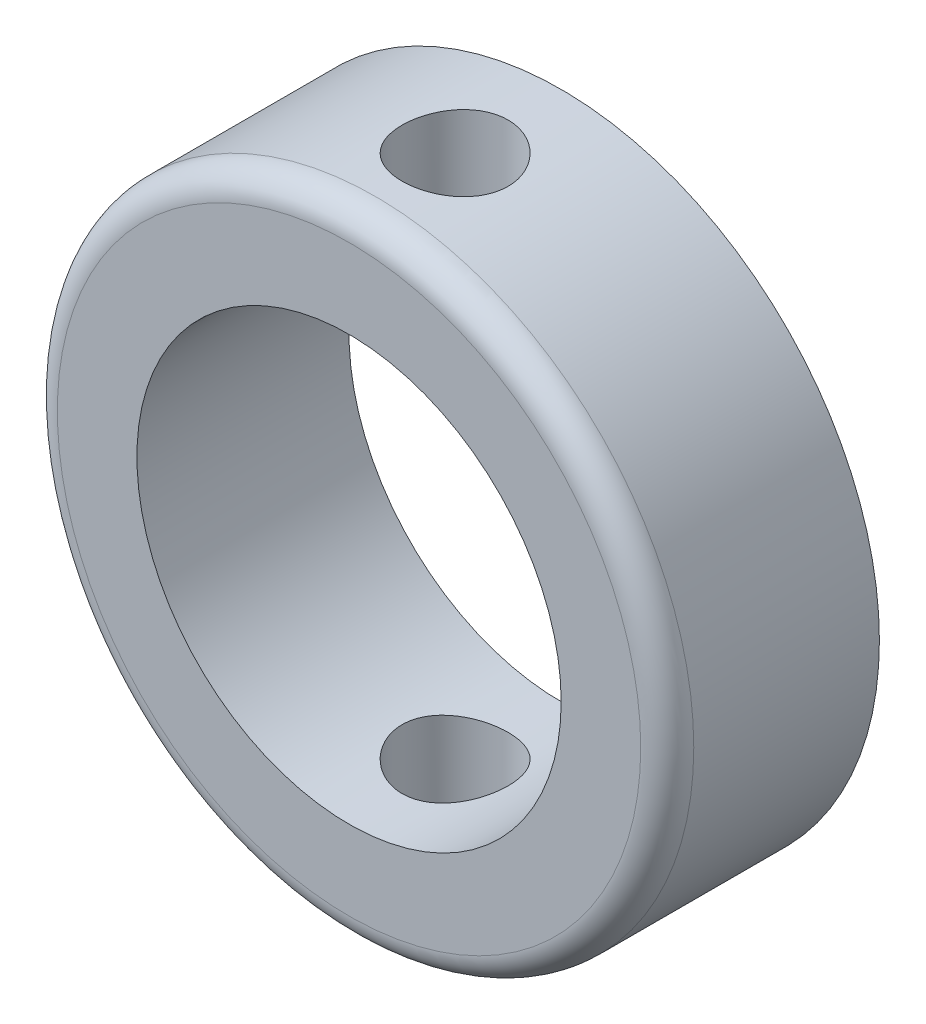
from build123d import *

# Parameters (mm, degrees)
SKETCH1_R           = 12
SKETCH1_R_2         = 8
BOSS_EXTRUDE1_DEPTH = 4
FILLET1_R           = 1
SKETCH3_R           = 2
CUT_EXTRUDE1_DEPTH  = 50


with BuildPart() as part:
    # Sketch1 → Boss-Extrude1 (new, symmetric)
    with BuildSketch(Plane.XY):
        Circle(SKETCH1_R)
        Circle(SKETCH1_R_2, mode=Mode.SUBTRACT)
    extrude(amount=BOSS_EXTRUDE1_DEPTH, both=True)

    # Fillet1
    fillet1_edges = [part.edges().sort_by_distance(p)[0] for p in [
        (-12, 0, 4),
    ]]
    fillet(fillet1_edges, radius=FILLET1_R)

    # Sketch3 → Cut-Extrude1 (cut, symmetric)
    with BuildSketch(Plane(origin=(0, 0, 0), x_dir=(1, 0, 0), z_dir=(0, 1, 0))):
        with Locations(Location((0, 0, 0), (0, 0, 270))):
            Circle(SKETCH3_R)
    extrude(amount=CUT_EXTRUDE1_DEPTH, both=True, mode=Mode.SUBTRACT)


solid = part.part
